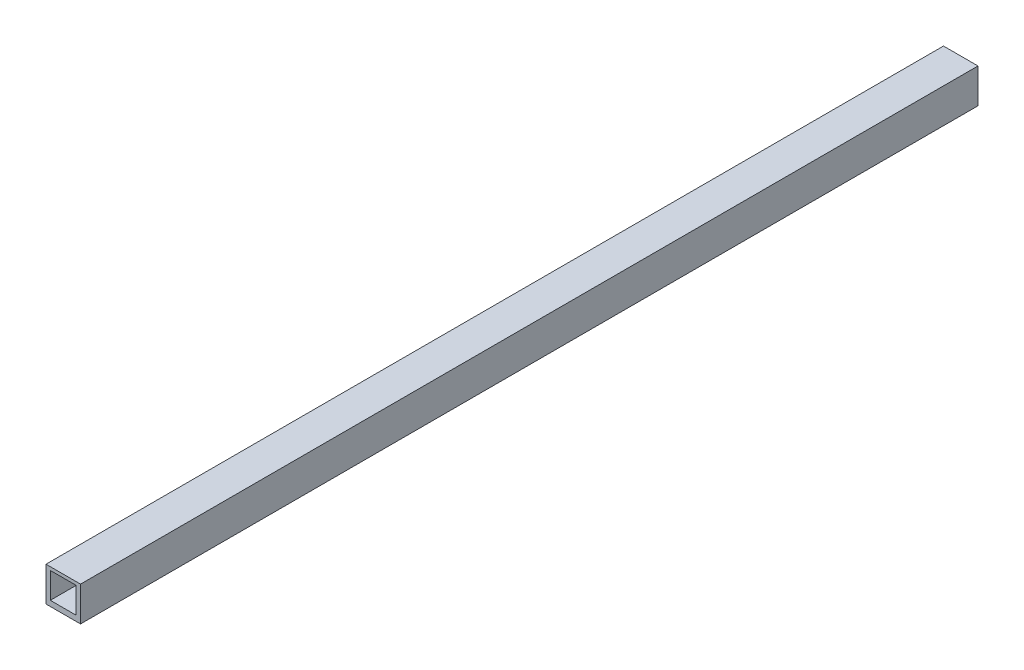
from build123d import *

# Parameters (mm, degrees)
SKETCH1_W           = 25.4
SKETCH1_H           = 25.4
BOSS_EXTRUDE1_DEPTH = 660.4
SKETCH2_W           = 19.05
SKETCH2_H           = 19.05
CUT_EXTRUDE1_DEPTH  = 660.4


with BuildPart() as part:
    # Sketch1 → Boss-Extrude1 (new body)
    with BuildSketch(Plane.XY):
        with Locations((0, -0.789265537)):
            Rectangle(SKETCH1_W, SKETCH1_H)
    extrude(amount=BOSS_EXTRUDE1_DEPTH)

    # Sketch2 → Cut-Extrude1 (cut)
    with BuildSketch(Plane.XY.offset(660.4)):
        Rectangle(SKETCH2_W, SKETCH2_H)
    extrude(amount=-CUT_EXTRUDE1_DEPTH, mode=Mode.SUBTRACT)


solid = part.part
